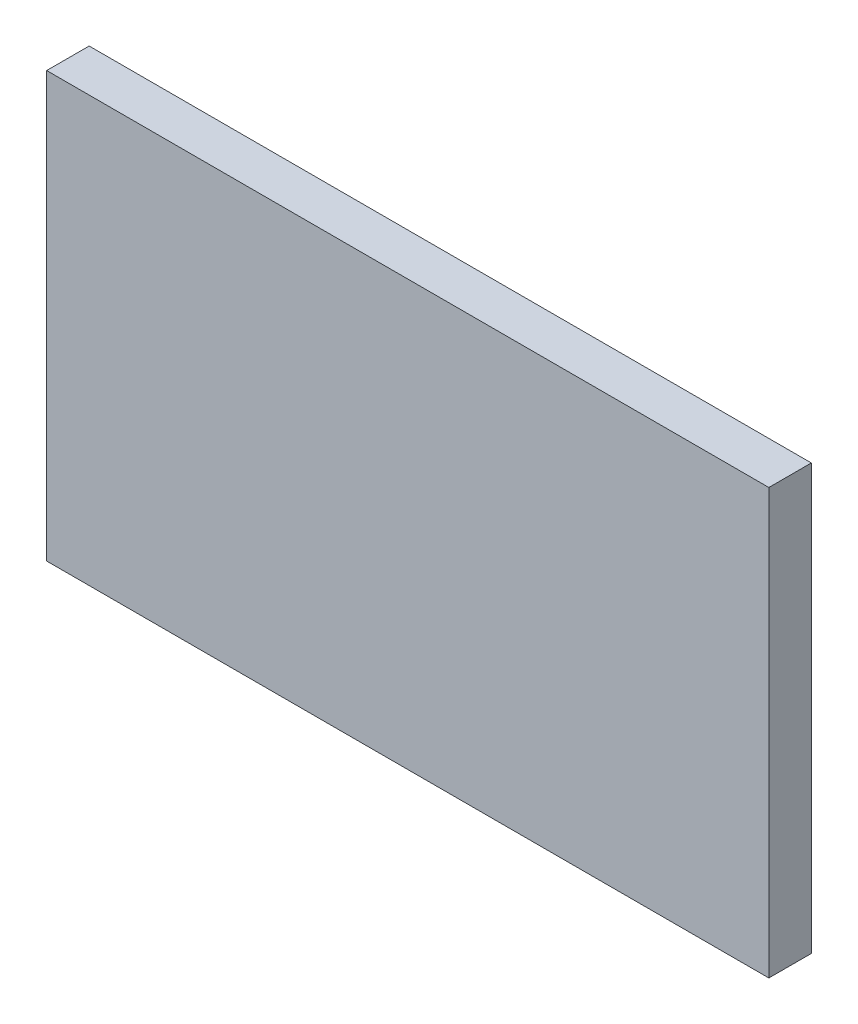
from build123d import *

# Parameters (mm, degrees)
SKETCH1_W           = 107.95
SKETCH1_H           = 63.5
BOSS_EXTRUDE1_DEPTH = 6.35


with BuildPart() as part:
    # Sketch1 → Boss-Extrude1 (new body)
    with BuildSketch(Plane.XY):
        Rectangle(SKETCH1_W, SKETCH1_H)
    extrude(amount=BOSS_EXTRUDE1_DEPTH)


solid = part.part
